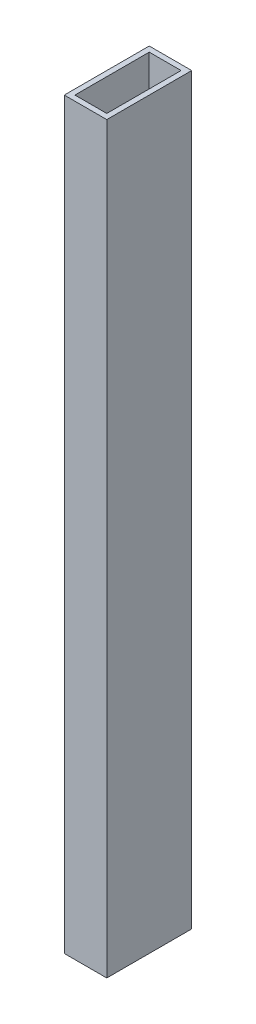
from build123d import *

# Parameters (mm, degrees)
SKETCH1_W           = 25.4
SKETCH1_H           = 50.8
SKETCH1_W_2         = 19.05
SKETCH1_H_2         = 44.45
BOSS_EXTRUDE1_DEPTH = 444.5


with BuildPart() as part:
    # Sketch1 → Boss-Extrude1 (new body)
    with BuildSketch(Plane(origin=(0, 0, 0), x_dir=(1, 0, 0), z_dir=(0, 1, 0))):
        Rectangle(SKETCH1_W, SKETCH1_H)
        Rectangle(SKETCH1_W_2, SKETCH1_H_2, mode=Mode.SUBTRACT)
    extrude(amount=BOSS_EXTRUDE1_DEPTH)


solid = part.part
